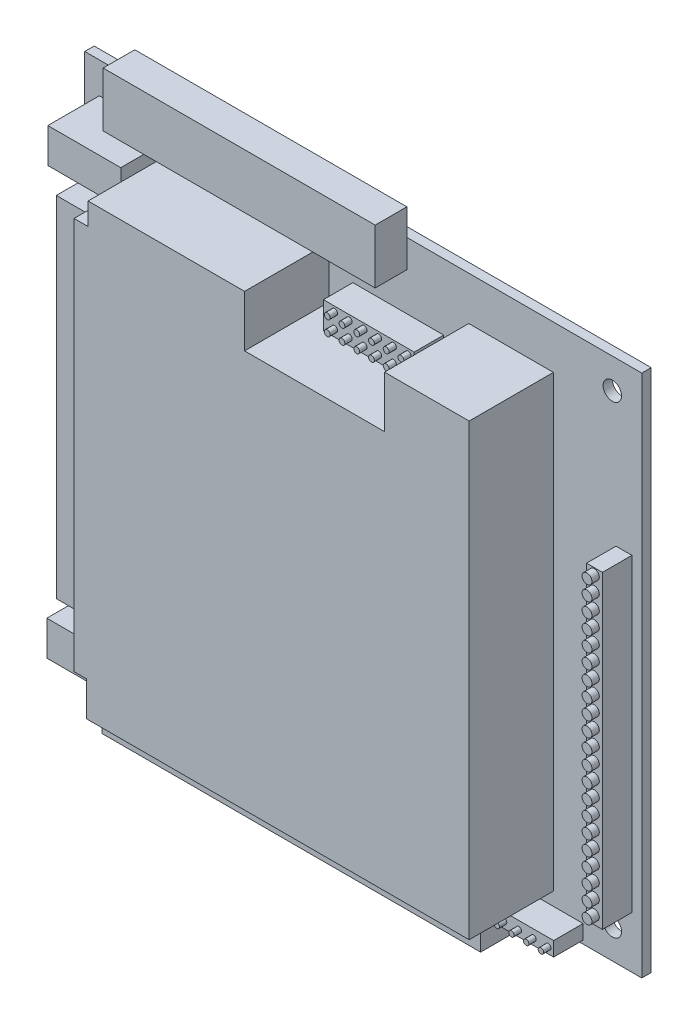
from build123d import *

# Parameters (mm, degrees)
SKETCH1_W                    = 96.0628
SKETCH1_H                    = 90.3478
PCB_DEPTH                    = 1.6256
SKETCH5_R                    = 1.5875
PCB_HOLES_DEPTH              = 66.957101229
PCI_104_CONNECTOR_DEPTH      = 9.2964
PCI_104_CONNECTOR_DEPTH_BACK = 12.6238
SKETCH2_W                    = 7.9756
SKETCH2_H                    = 60.2234
SKETCH6_W                    = 65.278
SKETCH6_H                    = 7.366
SKETCH6_W_2                  = 46.9138
SKETCH6_H_2                  = 9.398
PCB_EDGE_CONNS_DEPTH         = 5.461
HEAT_SINK_DEPTH              = 14.5288
SKETCH8_W                    = 12.578663299
SKETCH8_H                    = 5.969
SKETCH8_W_2                  = 12.468978526
CUT_EXTRUDE1_DEPTH           = 5.6388
SKETCH9_W                    = 24.13
SKETCH9_H                    = 8.89
CUT_EXTRUDE2_DEPTH           = 14.5288
SKETCH10_W                   = 15.661416919
SKETCH10_H                   = 4.637831463
SKETCH10_W_2                 = 10.456810418
SKETCH10_H_2                 = 2.475294653
SKETCH10_W_3                 = 2.739234778
SKETCH10_H_3                 = 53.34
BOSS_EXTRUDE1_DEPTH          = 5.08
SKETCH11_R                   = 0.504502566
BOSS_EXTRUDE2_DEPTH          = 1.27
LPATTERN1_COUNT              = 6
LPATTERN1_PITCH              = 2.54
LPATTERN1_COUNT_DIR2         = 2
LPATTERN1_PITCH_DIR2         = 2.54
SKETCH12_R                   = 0.464941127
BOSS_EXTRUDE3_DEPTH          = 1.27
LPATTERN2_COUNT              = 4
LPATTERN2_PITCH              = 2.54
SKETCH13_R                   = 0.853348332
BOSS_EXTRUDE4_DEPTH          = 1.27
LPATTERN3_COUNT              = 21
LPATTERN3_PITCH              = 2.54


with BuildPart() as part:
    # Sketch1 → PCB (new body)
    with BuildSketch(Plane.XY):
        Rectangle(SKETCH1_W, SKETCH1_H)
    extrude(amount=PCB_DEPTH)

    # Sketch5 → PCB_Holes (cut, through all)
    with BuildSketch(Plane.XY.offset(1.6256)):
        with Locations((-42.7736, 36.83)):
            Circle(SKETCH5_R)
        with Locations((42.9514, 40.005)):
            Circle(SKETCH5_R)
        with Locations((42.9514, -40.005)):
            Circle(SKETCH5_R)
        with Locations((-42.7736, -36.83)):
            Circle(SKETCH5_R)
    extrude(amount=-PCB_HOLES_DEPTH, mode=Mode.SUBTRACT)

    # Sketch2 → PCI-104_Connector (add, two sides: drawn at the far end of the back side and taken through both)
    with BuildSketch(Plane.XY.offset(1.6256).offset(-PCI_104_CONNECTOR_DEPTH_BACK)):
        with Locations((-39.6494, 0.4064)):
            Rectangle(SKETCH2_W, SKETCH2_H)
    extrude(amount=PCI_104_CONNECTOR_DEPTH + PCI_104_CONNECTOR_DEPTH_BACK)

    # Sketch6 → PCB_Edge_Conns (add)
    with BuildSketch(Plane.XY.offset(1.6256)):
        with Locations((-6.9342, -46.0629)):
            Rectangle(SKETCH6_W, SKETCH6_H)
        with Locations((-15.9385, 45.0469)):
            Rectangle(SKETCH6_W_2, SKETCH6_H_2)
    extrude(amount=PCB_EDGE_CONNS_DEPTH)

    # Sketch7 → Heat Sink (add)
    with BuildSketch(Plane.XY.offset(1.6256)):
        Polygon((32.7914, 37.6555), (-32.929016802, 37.6555), (-32.929016802, 39.8145), (-45.507680101, 39.8145), (-45.507680101, 33.8455), (-35.347680101, 33.8455), (-35.347680101, -33.8455), (-45.681124108, -33.8455), (-45.681124108, -39.8145), (32.7914, -39.8145), align=None)
    extrude(amount=HEAT_SINK_DEPTH)

    # Sketch8 → Cut-Extrude1 (cut)
    with BuildSketch(Plane.XY.offset(16.1544)):
        with Locations((-39.218348452, 36.83)):
            Rectangle(SKETCH8_W, SKETCH8_H)
        with Locations((-39.446634845, -36.83)):
            Rectangle(SKETCH8_W_2, SKETCH8_H)
    extrude(amount=-CUT_EXTRUDE1_DEPTH, mode=Mode.SUBTRACT)

    # Sketch9 → Cut-Extrude2 (cut)
    with BuildSketch(Plane.XY.offset(16.1544)):
        with Locations((6.130519899, 33.2105)):
            Rectangle(SKETCH9_W, SKETCH9_H)
    extrude(amount=-CUT_EXTRUDE2_DEPTH, mode=Mode.SUBTRACT)

    # Sketch10 → Boss-Extrude1 (add)
    with BuildSketch(Plane.XY.offset(1.6256)):
        with Locations((6.040104986, 31.44690823)):
            Rectangle(SKETCH10_W, SKETCH10_H)
        with Locations((32.684734403, -43.337331173)):
            Rectangle(SKETCH10_W_2, SKETCH10_H_2)
        with Locations((44.95848031, -9.569270887)):
            Rectangle(SKETCH10_W_3, SKETCH10_H_3)
    extrude(amount=BOSS_EXTRUDE1_DEPTH)

    # Sketch11 → Boss-Extrude2 (add)
    with BuildSketch(Plane.XY.offset(6.7056)):
        with Locations((12.839671728, 30.359366813)):
            Circle(SKETCH11_R)
    boss_extrude2 = extrude(amount=BOSS_EXTRUDE2_DEPTH)

    # LPattern1: Boss-Extrude2 6 × 2
    with Locations(*[(-i * LPATTERN1_PITCH, j * LPATTERN1_PITCH_DIR2, 0) for i in range(LPATTERN1_COUNT) for j in range(LPATTERN1_COUNT_DIR2) if (i, j) != (0, 0)]):
        add(boss_extrude2)

    # Sketch12 → Boss-Extrude3 (add)
    with BuildSketch(Plane.XY.offset(6.7056)):
        with Locations(Location((36.988776709, -43.465687533, 0), (0, 0, 180))):
            Circle(SKETCH12_R)
    boss_extrude3 = extrude(amount=BOSS_EXTRUDE3_DEPTH)

    # LPattern2: Boss-Extrude3 ×4
    with Locations(*[(-i * LPATTERN2_PITCH, 0, 0) for i in range(1, LPATTERN2_COUNT)]):
        add(boss_extrude3)

    # Sketch13 → Boss-Extrude4 (add)
    with BuildSketch(Plane.XY.offset(6.7056)):
        with Locations(Location((44.932694638, -34.705275196, 0), (0, 0, 180))):
            Circle(SKETCH13_R)
    boss_extrude4 = extrude(amount=BOSS_EXTRUDE4_DEPTH)

    # LPattern3: Boss-Extrude4 ×21
    with Locations(*[(0, i * LPATTERN3_PITCH, 0) for i in range(1, LPATTERN3_COUNT)]):
        add(boss_extrude4)


solid = part.part
